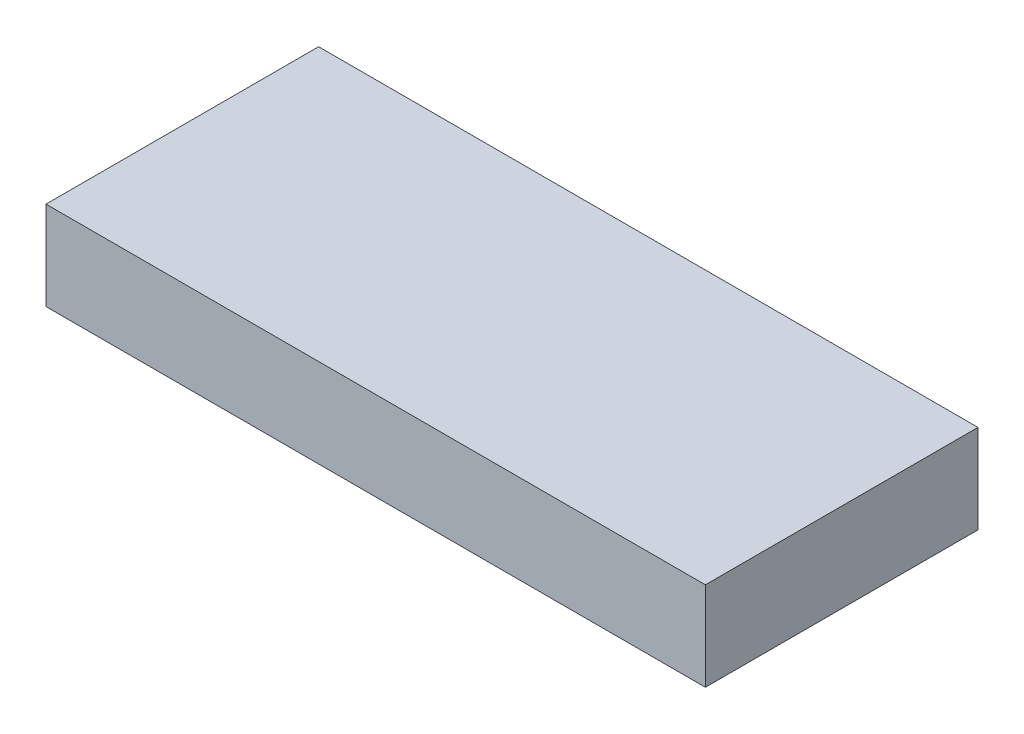
from build123d import *

# Parameters (mm, degrees)
SKETCH_1_W      = 52
SKETCH_1_H      = 21.5
EXTRUDE_1_DEPTH = 7


with BuildPart() as part:
    # 草圖1 → 填料-伸長1 (new body)
    with BuildSketch(Plane(origin=(0, 0, 0), x_dir=(1, 0, 0), z_dir=(0, 1, 0))):
        with Locations((26, 10.75)):
            Rectangle(SKETCH_1_W, SKETCH_1_H)
    extrude(amount=EXTRUDE_1_DEPTH)


solid = part.part
